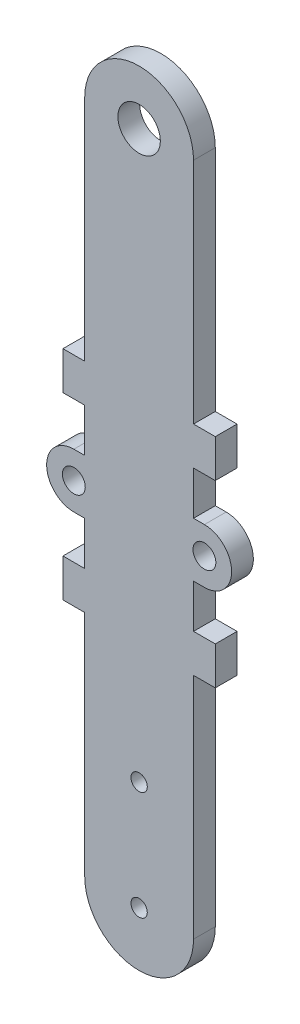
from build123d import *

# Parameters (mm, degrees)
ESQUISSE1_W             = 20
ESQUISSE1_H             = 144
ESQUISSE1_R             = 1.5
ESQUISSE1_R_2           = 3.9
BOSS_EXTRU_1_DEPTH      = 4
CONG_1_RADIUS           = 10
CONG_1_LENGTH           = 4
ESQUISSE2_W             = 4
ESQUISSE2_H             = 7
BOSS_EXTRU_2_DEPTH      = 4
ESQUISSE3_R             = 1.5
ENL_V_MAT_EXTRU_1_DEPTH = 75.087785768
CONG_2_RADIUS           = 10
CONG_2_LENGTH           = 4
ESQUISSE4_R             = 2.1
ENL_V_MAT_EXTRU_2_DEPTH = 75.087785768


with BuildPart() as part:
    # Esquisse1 → Boss.-Extru.1 (new body)
    with BuildSketch(Plane.XY):
        Rectangle(ESQUISSE1_W, ESQUISSE1_H)
        with Locations((0, -62)):
            Circle(ESQUISSE1_R, mode=Mode.SUBTRACT)
        with Locations((0, 62)):
            Circle(ESQUISSE1_R_2, mode=Mode.SUBTRACT)
    extrude(amount=BOSS_EXTRU_1_DEPTH)

    # Congé1: full round fillet: the end face becomes a half cylinder, R = half its width
    cong_1_face = Plane((0, 72, 2), x_dir=(0, 0, 1), z_dir=(0, 1, 0))  # on the end face: x along it, z out of the body
    cong_1_slab = cong_1_face.offset(-CONG_1_RADIUS / 2) * Box(CONG_1_LENGTH, 2 * CONG_1_RADIUS, CONG_1_RADIUS, mode=Mode.PRIVATE)  # the body's end, R deep
    cong_1_round = Plane((0, 62, 2), x_dir=(0, 1, 0), z_dir=(0, 0, 1)) * Cylinder(CONG_1_RADIUS, CONG_1_LENGTH, mode=Mode.PRIVATE)  # its axis R under the face
    add(cong_1_slab - cong_1_round, mode=Mode.SUBTRACT)

    # Esquisse2 → Boss.-Extru.2 (add)
    with BuildSketch(Plane.XY.offset(4)):
        with BuildLine():
            Line((-10, 0.640312424), (-10, 5))
            Line((-10, 5), (-12, 5))
            ThreePointArc((-12, 5), (-17, 0), (-12, -5))
            Line((-12, -5), (-10, -5))
            Line((-10, -5), (-10, -0.640312424))
            ThreePointArc((-10, -0.640312424), (-14.1, 0), (-10, 0.640312424))
        make_face()
        with Locations((-12, 16.5)):
            Rectangle(ESQUISSE2_W, ESQUISSE2_H)
        with Locations((-12, -16.5)):
            Rectangle(ESQUISSE2_W, ESQUISSE2_H)
    boss_extru_2 = extrude(amount=-BOSS_EXTRU_2_DEPTH)

    # Esquisse3 → Enlèv. mat.-Extru.1 (cut, through all)
    with BuildSketch(Plane(origin=(0, 0, 0), x_dir=(-1, 0, 0), z_dir=(0, 0, -1))):
        with Locations((0, -42)):
            Circle(ESQUISSE3_R)
    extrude(amount=-ENL_V_MAT_EXTRU_1_DEPTH, mode=Mode.SUBTRACT)

    # Congé2: full round fillet: the end face becomes a half cylinder, R = half its width
    cong_2_face = Plane((0, -72, 2), x_dir=(0, 0, 1), z_dir=(0, -1, 0))  # on the end face: x along it, z out of the body
    cong_2_slab = cong_2_face.offset(-CONG_2_RADIUS / 2) * Box(CONG_2_LENGTH, 2 * CONG_2_RADIUS, CONG_2_RADIUS, mode=Mode.PRIVATE)  # the body's end, R deep
    cong_2_round = Plane((0, -62, 2), x_dir=(0, -1, 0), z_dir=(0, 0, 1)) * Cylinder(CONG_2_RADIUS, CONG_2_LENGTH, mode=Mode.PRIVATE)  # its axis R under the face
    add(cong_2_slab - cong_2_round, mode=Mode.SUBTRACT)

    # Esquisse4 → Enlèv. mat.-Extru.2 (cut, through all)
    with BuildSketch(Plane.XY.offset(4)):
        with Locations((-12, 0)):
            Circle(ESQUISSE4_R)
    enl_v_mat_extru_2 = extrude(amount=-ENL_V_MAT_EXTRU_2_DEPTH, mode=Mode.SUBTRACT)

    # Symétrie1: Boss.-Extru.2, Enlèv. mat.-Extru.2 across plane
    add(boss_extru_2.mirror(Plane(origin=(0, 0, 0), x_dir=(0, 0, 1), z_dir=(1, 0, 0))))
    add(enl_v_mat_extru_2.mirror(Plane(origin=(0, 0, 0), x_dir=(0, 0, 1), z_dir=(1, 0, 0))), mode=Mode.SUBTRACT)


solid = part.part
